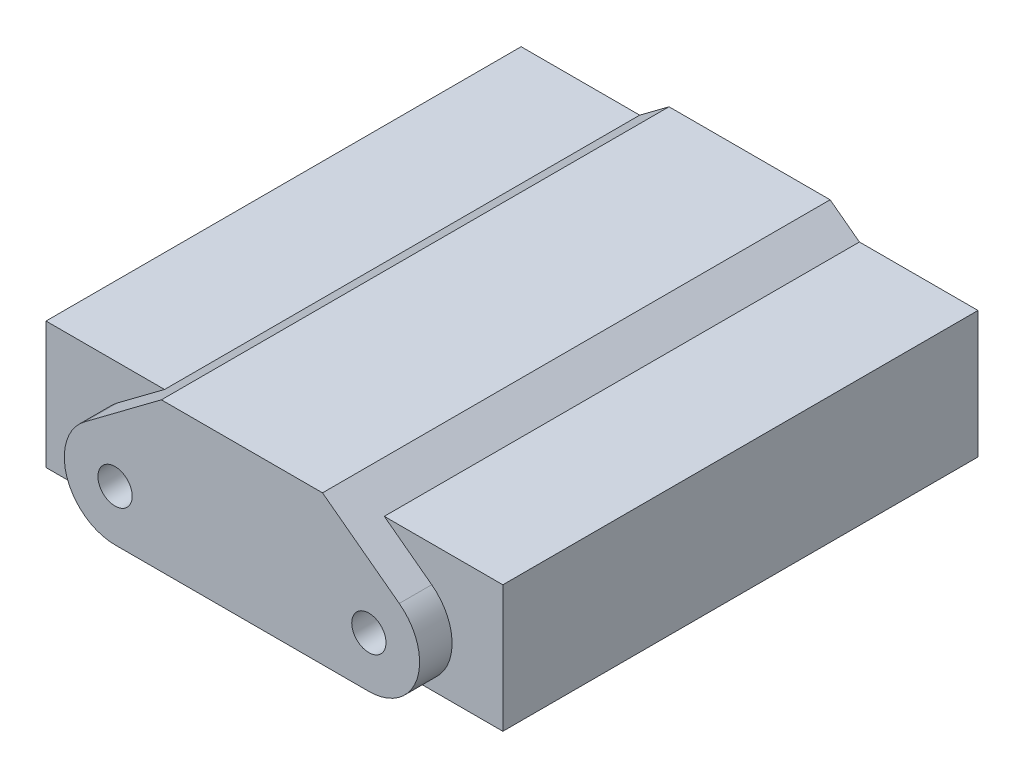
from build123d import *

# Parameters (mm, degrees)
SKETCH_1_R          = 1.35
EXTRUDE_1_DEPTH     = 40
EXTRUDE_2_DEPTH     = 10
SKETCH_3_W          = 36
SKETCH_3_H          = 37.441664415
SKETCH_3_R          = 11
EXTRUDE_3_DEPTH     = 5
SKETCH_7_W          = 36
SKETCH_7_H          = 37.441664415
CUT_EXTRUDE_4_DEPTH = 5
CUT_EXTRUDE_START   = -12
SKETCH_8_R          = 1.35
CUT_EXTRUDE_5_DEPTH = 12
SKETCH_10_R         = 1.34
SKETCH_10_R_2       = 1.35
CUT_EXTRUDE_6_DEPTH = 52


with BuildPart() as part:
    # 草图1 → 凸台-拉伸1 (new body)
    with BuildSketch(Plane.XY):
        with BuildLine():
            Line((-10, -4), (10, -4))
            ThreePointArc((10, -4), (13.795550466, -1.262456597), (12.395858862, 3.203101671))
            Line((12.395858862, 3.203101671), (6.347732719, 7.726984491))
            Line((6.347732719, 7.726984491), (0, 7.726984491))
            Line((0, 7.726984491), (-6.347732719, 7.726984491))
            Line((-6.347732719, 7.726984491), (-12.395858862, 3.203101671))
            ThreePointArc((-12.395858862, 3.203101671), (-13.795550466, -1.262456597), (-10, -4))
        make_face()
        with Locations((10, 0)):
            Circle(SKETCH_1_R, mode=Mode.SUBTRACT)
        with Locations((-10, 0)):
            Circle(SKETCH_1_R, mode=Mode.SUBTRACT)
    extrude(amount=EXTRUDE_1_DEPTH)

    # 草图2 → 凸台-拉伸2 (add)
    with BuildSketch(Plane.XZ.offset(4)):
        Polygon((-10, 37.441664415), (-18, 37.441664415), (-18, 0), (0, 0), (10, 0), (18, 0), (18, 37.441664415), align=None)
    extrude(amount=-EXTRUDE_2_DEPTH)

    # 草图3 → 凸台-拉伸3 (add)
    with BuildSketch(Plane.XZ.offset(4)):
        with Locations((0, 18.720832208)):
            Rectangle(SKETCH_3_W, SKETCH_3_H)
        with Locations(Location((0, 16, 0), (0, 0, 270))):
            Circle(SKETCH_3_R, mode=Mode.SUBTRACT)
    extrude(amount=EXTRUDE_3_DEPTH)

    # 草图7 → 切除-拉伸4 (cut)
    with BuildSketch(Plane.XZ.offset(9)):
        with Locations((0, 18.720832208)):
            Rectangle(SKETCH_7_W, SKETCH_7_H)
    extrude(amount=-CUT_EXTRUDE_4_DEPTH, mode=Mode.SUBTRACT)

    # 草图8 → 切除-拉伸5 (cut)
    with BuildSketch(Plane.XY.offset(37.441664415).offset(CUT_EXTRUDE_START)):
        with Locations((10, 0)):
            Circle(SKETCH_8_R)
        with Locations((-10, 0)):
            Circle(SKETCH_8_R)
    extrude(amount=CUT_EXTRUDE_5_DEPTH, mode=Mode.SUBTRACT)

    # 草图10 → 切除-拉伸6 (cut)
    with BuildSketch(Plane(origin=(0, 0, 0), x_dir=(-1, 0, 0), z_dir=(0, 0, -1))):
        with Locations((10, 0)):
            Circle(SKETCH_10_R)
        with Locations((-10, 0)):
            Circle(SKETCH_10_R_2)
    extrude(amount=-CUT_EXTRUDE_6_DEPTH, mode=Mode.SUBTRACT)


solid = part.part
